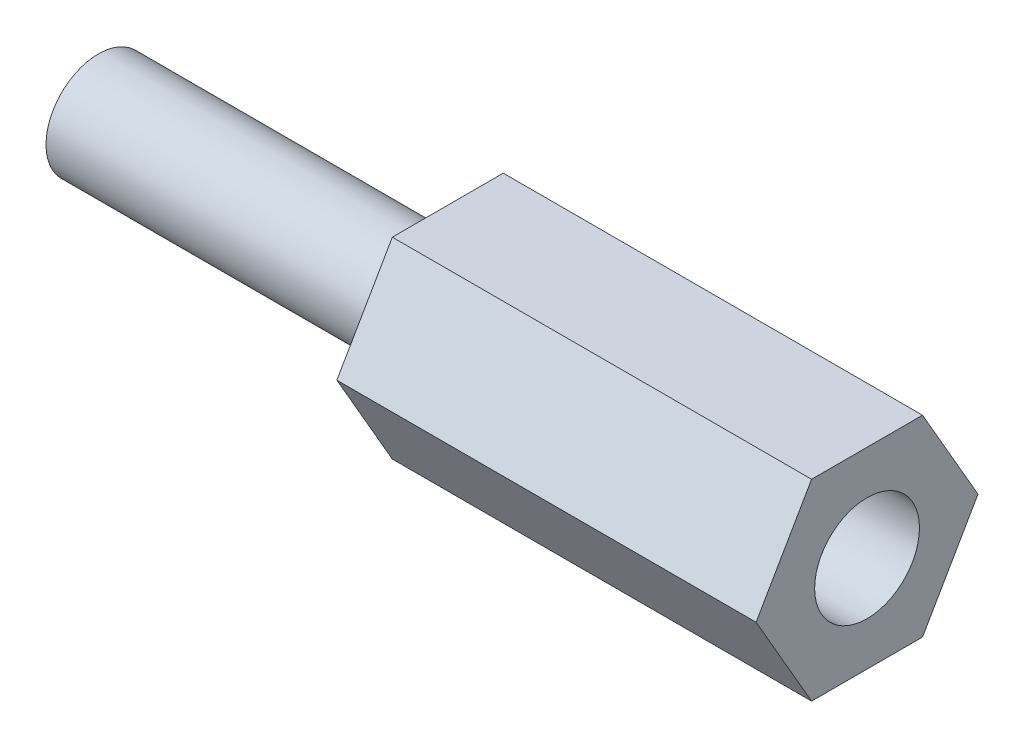
from build123d import *

# Parameters (mm, degrees)
SKETCH2_R                = 1.5
BOSS_EXTRUDE1_DEPTH      = 12
BOSS_EXTRUDE2_DEPTH      = 10
BOSS_EXTRUDE2_DEPTH_BACK = 2
SKETCH3_R                = 1.5


with BuildPart() as part:
    # Sketch2 → Boss-Extrude1 (new body)
    with BuildSketch(Plane(origin=(0, 0, 0), x_dir=(0, 0, -1), z_dir=(1, 0, 0))):
        Polygon((1.58771324, 2.75), (-1.58771324, 2.75), (-3.175426481, 0), (-1.58771324, -2.75), (1.58771324, -2.75), (3.175426481, 0), align=None)
        Circle(SKETCH2_R, mode=Mode.SUBTRACT)
    extrude(amount=BOSS_EXTRUDE1_DEPTH)

    # Sketch3 → Boss-Extrude2 (add, two sides: drawn at the far end of the back side and taken through both)
    with BuildSketch(Plane.ZY.offset(-BOSS_EXTRUDE2_DEPTH_BACK)):
        Circle(SKETCH3_R)
    extrude(amount=BOSS_EXTRUDE2_DEPTH + BOSS_EXTRUDE2_DEPTH_BACK)


solid = part.part
